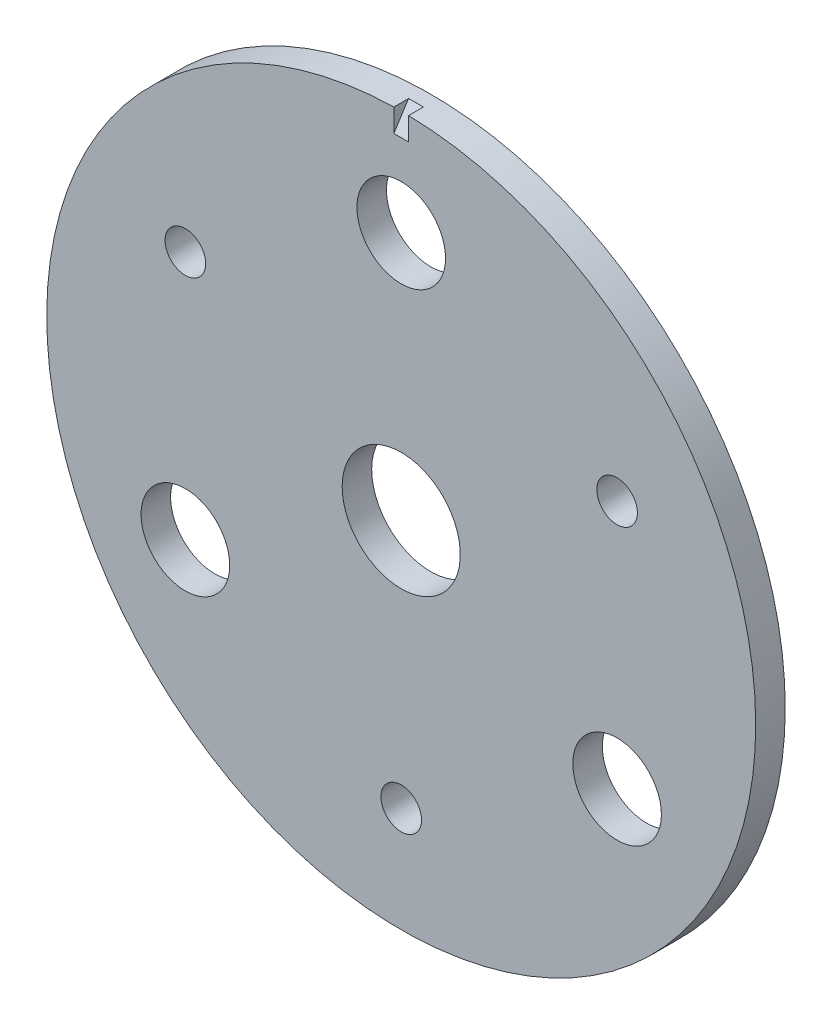
from build123d import *

# Parameters (mm, degrees)
SKETCH1_R                        = 48
SKETCH1_R_2                      = 8
EX_CARRIER_FRONT_PLATE_4MM_DEPTH = 2
SKETCH2_R                        = 6
CUT_PIN_HOLE_12_DEPTH            = 69
PAT_PIN_HOLES_3X120_COUNT        = 3
CUT_EXTRUDE1_DEPTH               = 1
SKETCH4_R                        = 2.75
CUT_EXTRUDE2_DEPTH               = 68.911707385
SKETCH5_R                        = 2.75
CUT_EXTRUDE3_DEPTH               = 68.911707385
CIRPATTERN1_COUNT                = 3
CIRPATTERN2_COUNT                = 3


with BuildPart() as part:
    # Sketch1 → EX_Carrier_Front_Plate_4mm (new, symmetric)
    with BuildSketch(Plane.XY):
        Circle(SKETCH1_R)
        Circle(SKETCH1_R_2, mode=Mode.SUBTRACT)
    extrude(amount=EX_CARRIER_FRONT_PLATE_4MM_DEPTH, both=True)

    # Sketch2 → CUT_Pin_Hole_Ø12 (cut, symmetric)
    with BuildSketch(Plane.XY.offset(2)):
        with Locations((0, 33.75)):
            Circle(SKETCH2_R)
    cut_pin_hole_12 = extrude(amount=CUT_PIN_HOLE_12_DEPTH, both=True, mode=Mode.SUBTRACT)

    # PAT_Pin_Holes_3x120: CUT_Pin_Hole_Ø12 ×3 about axis
    pat_pin_holes_3x120_axis = Axis((0, 0, 0), (0, 0, 1))
    for i in range(1, PAT_PIN_HOLES_3X120_COUNT):
        add(cut_pin_hole_12.rotate(pat_pin_holes_3x120_axis, i * 360 / PAT_PIN_HOLES_3X120_COUNT), mode=Mode.SUBTRACT)

    # Sketch3 → Cut-Extrude1 (cut, symmetric)
    with BuildSketch(Plane(origin=(0, 0, 0), x_dir=(0, 0, -1), z_dir=(1, 0, 0))):
        Polygon((-2, 44.889744608), (0, 48), (-2, 48), align=None)
    extrude(amount=CUT_EXTRUDE1_DEPTH, both=True, mode=Mode.SUBTRACT)

    # Sketch4 → Cut-Extrude2 (cut, through all)
    with BuildSketch(Plane.XY):
        with Locations((0, -33.75)):
            Circle(SKETCH4_R)
    cut_extrude2 = extrude(amount=CUT_EXTRUDE2_DEPTH, mode=Mode.SUBTRACT)

    # Sketch5 → Cut-Extrude3 (cut, through all)
    with BuildSketch(Plane.XY):
        with Locations((0, -33.75)):
            Circle(SKETCH5_R)
    cut_extrude3 = extrude(amount=-CUT_EXTRUDE3_DEPTH, mode=Mode.SUBTRACT)

    # CirPattern1: Cut-Extrude2 ×3 about axis
    cirpattern1_axis = Axis((0, 0, 0), (0, 0, 1))
    for i in range(1, CIRPATTERN1_COUNT):
        add(cut_extrude2.rotate(cirpattern1_axis, i * 360 / CIRPATTERN1_COUNT), mode=Mode.SUBTRACT)

    # CirPattern2: Cut-Extrude3 ×3 about axis
    cirpattern2_axis = Axis((0, 0, -2.208265016), (0, 0, 1))
    for i in range(1, CIRPATTERN2_COUNT):
        add(cut_extrude3.rotate(cirpattern2_axis, i * 360 / CIRPATTERN2_COUNT), mode=Mode.SUBTRACT)


solid = part.part
